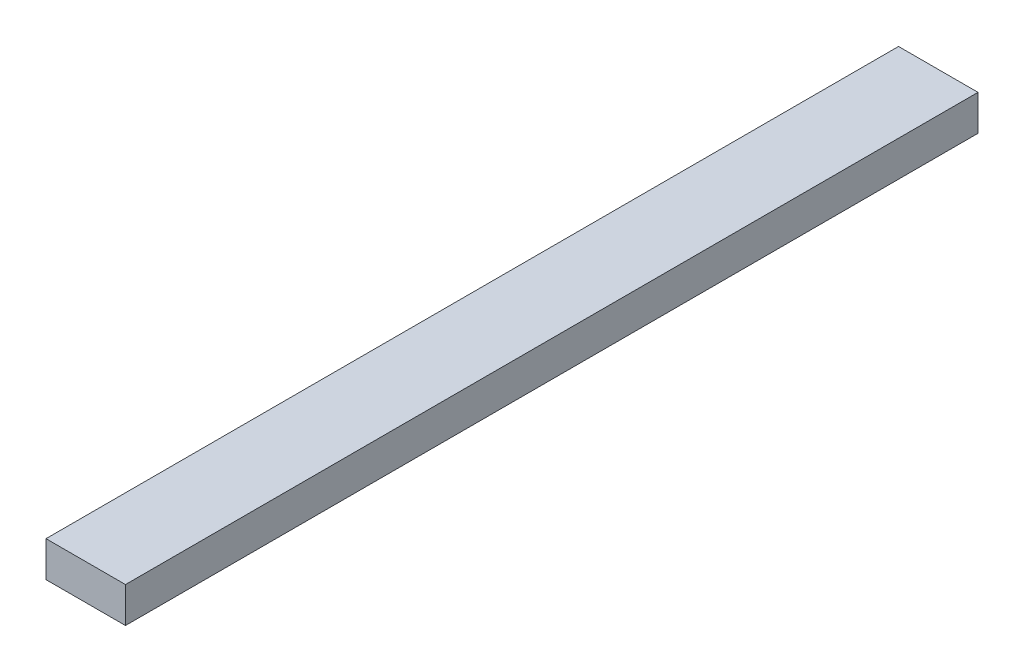
from build123d import *

# Parameters (mm, degrees)
SKETCH1_W           = 16.6624
SKETCH1_H           = 37.2872
BOSS_EXTRUDE1_DEPTH = 200


with BuildPart() as part:
    # Sketch1 → Boss-Extrude1 (new, symmetric)
    with BuildSketch(Plane(origin=(0, 0, 0), x_dir=(0, 1, 0), z_dir=(0, 0, 1))):
        Rectangle(SKETCH1_W, SKETCH1_H)
    extrude(amount=BOSS_EXTRUDE1_DEPTH, both=True)


solid = part.part
